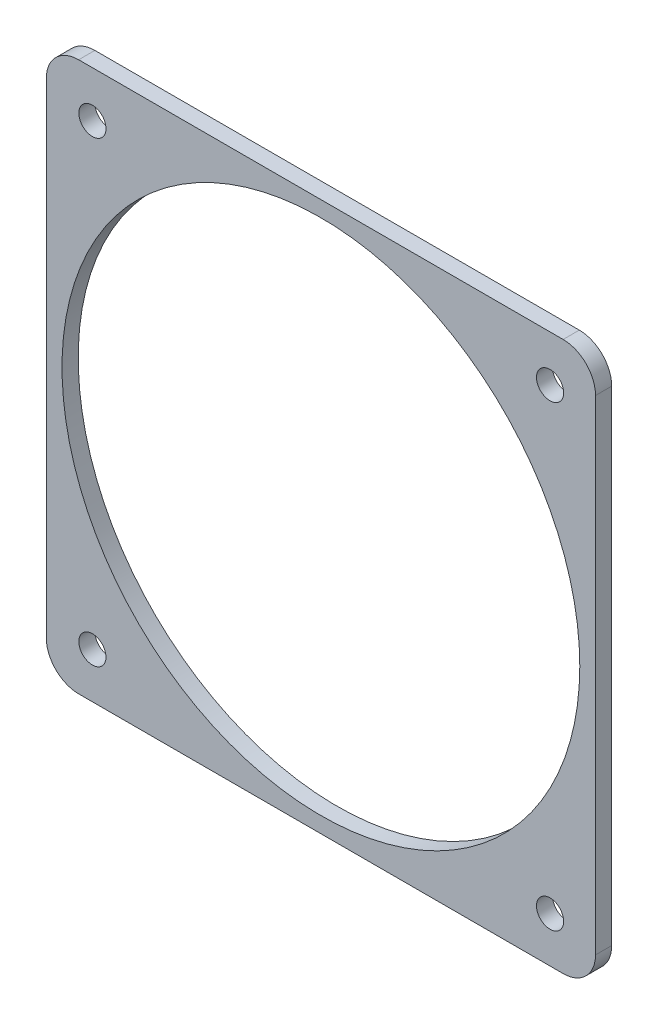
from build123d import *

# Parameters (mm, degrees)
SKETCH1_W           = 107.763073452
SKETCH1_H           = 107.763073452
BOSS_EXTRUDE1_DEPTH = 3.175
CUT_EXTRUDE2_REACH  = 78.266
SKETCH4_R           = 50.8
FILLET1_R           = 6.35
CUT_EXTRUDE3_REACH  = 78.266
SKETCH5_R           = 2.665000004


with BuildPart() as part:
    # Sketch1 → Boss-Extrude1 (new body)
    with BuildSketch(Plane.XY):
        Rectangle(SKETCH1_W, SKETCH1_H)
    extrude(amount=BOSS_EXTRUDE1_DEPTH)

    # Sketch4 → Cut-Extrude2 (cut, up to next)
    with BuildSketch(Plane.XY.offset(3.175), mode=Mode.PRIVATE) as cut_extrude2_sk1:
        Circle(SKETCH4_R)
    cut_extrude2_tool1 = extrude(cut_extrude2_sk1.sketch, amount=-CUT_EXTRUDE2_REACH, mode=Mode.PRIVATE) & part.part
    add(cut_extrude2_tool1.solids().sort_by_distance((0, 0, 3.175))[0], mode=Mode.SUBTRACT)

    # Fillet1
    fillet1_edges = [part.edges().sort_by_distance(p)[0] for p in [
        (-53.881536726, -53.881536726, 1.5875),
        (-53.881536726, 53.881536726, 1.5875),
        (53.881536726, 53.881536726, 1.5875),
        (53.881536726, -53.881536726, 1.5875),
    ]]
    fillet(fillet1_edges, radius=FILLET1_R)

    # Sketch5 → Cut-Extrude3 (cut, up to next)
    with BuildSketch(Plane.XY.offset(3.175), mode=Mode.PRIVATE) as cut_extrude3_sk1:
        with Locations((-44.838745817, 44.838745817)):
            Circle(SKETCH5_R)
    cut_extrude3_tool1 = extrude(cut_extrude3_sk1.sketch, amount=-CUT_EXTRUDE3_REACH, mode=Mode.PRIVATE) & part.part
    # Sketch5 → Cut-Extrude3 (cut, up to next)
    with BuildSketch(Plane.XY.offset(3.175), mode=Mode.PRIVATE) as cut_extrude3_sk2:
        with Locations((44.963815393, 44.838745817)):
            Circle(SKETCH5_R)
    cut_extrude3_tool2 = extrude(cut_extrude3_sk2.sketch, amount=-CUT_EXTRUDE3_REACH, mode=Mode.PRIVATE) & part.part
    # Sketch5 → Cut-Extrude3 (cut, up to next)
    with BuildSketch(Plane.XY.offset(3.175), mode=Mode.PRIVATE) as cut_extrude3_sk3:
        with Locations((-44.838745817, -44.963815393)):
            Circle(SKETCH5_R)
    cut_extrude3_tool3 = extrude(cut_extrude3_sk3.sketch, amount=-CUT_EXTRUDE3_REACH, mode=Mode.PRIVATE) & part.part
    # Sketch5 → Cut-Extrude3 (cut, up to next)
    with BuildSketch(Plane.XY.offset(3.175), mode=Mode.PRIVATE) as cut_extrude3_sk4:
        with Locations((44.963815393, -44.963815393)):
            Circle(SKETCH5_R)
    cut_extrude3_tool4 = extrude(cut_extrude3_sk4.sketch, amount=-CUT_EXTRUDE3_REACH, mode=Mode.PRIVATE) & part.part
    add(cut_extrude3_tool1.solids().sort_by_distance((-44.838746, 44.838746, 3.175))[0], mode=Mode.SUBTRACT)
    add(cut_extrude3_tool2.solids().sort_by_distance((44.963815, 44.838746, 3.175))[0], mode=Mode.SUBTRACT)
    add(cut_extrude3_tool3.solids().sort_by_distance((-44.838746, -44.963815, 3.175))[0], mode=Mode.SUBTRACT)
    add(cut_extrude3_tool4.solids().sort_by_distance((44.963815, -44.963815, 3.175))[0], mode=Mode.SUBTRACT)


solid = part.part
